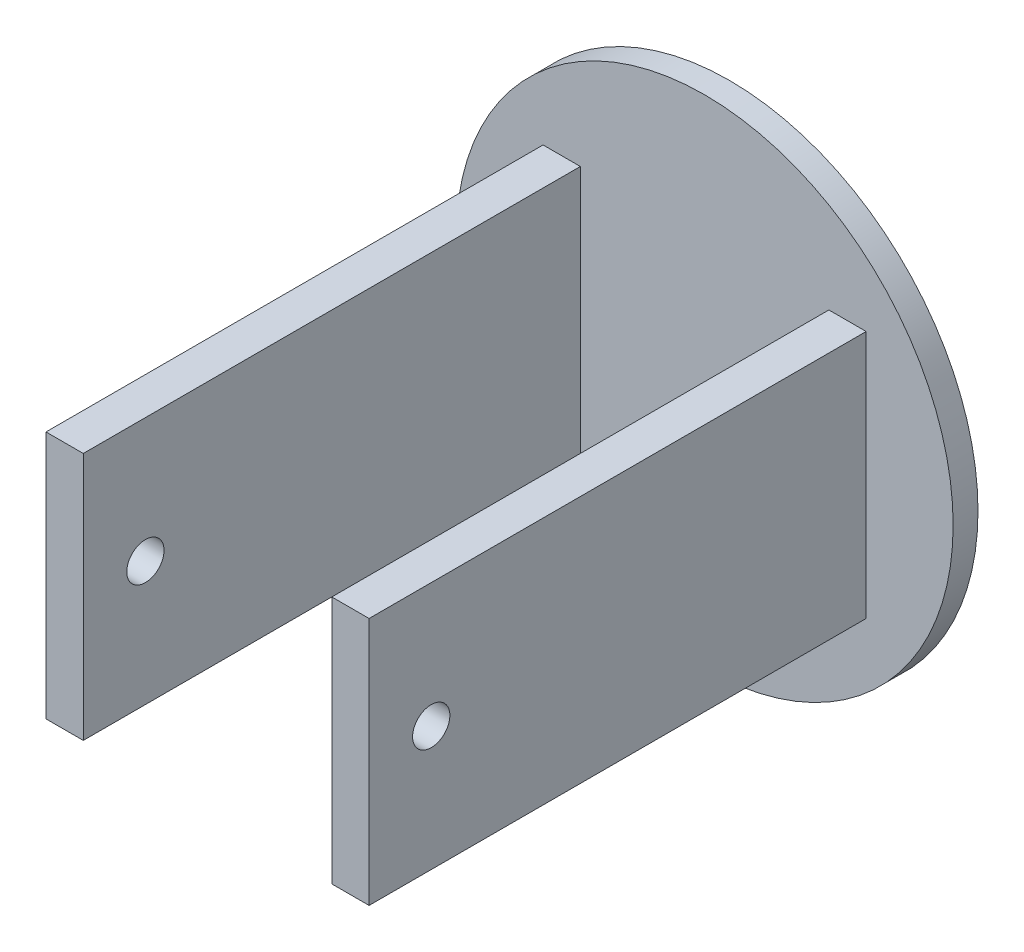
from build123d import *

# Parameters (mm, degrees)
SKETCH1_R           = 20
BOSS_EXTRUDE1_DEPTH = 2
SKETCH2_R           = 2
BOSS_EXTRUDE2_DEPTH = 1
SKETCH3_W           = 3
SKETCH3_H           = 20
BOSS_EXTRUDE3_DEPTH = 40
SKETCH5_R           = 1.5
CUT_EXTRUDE1_DEPTH  = 58.035076926


with BuildPart() as part:
    # Sketch1 → Boss-Extrude1 (new body)
    with BuildSketch(Plane.XY):
        Circle(SKETCH1_R)
    extrude(amount=BOSS_EXTRUDE1_DEPTH)

    # Sketch2 → Boss-Extrude2 (add)
    with BuildSketch(Plane(origin=(0, 0, 0), x_dir=(-1, 0, 0), z_dir=(0, 0, -1))):
        with Locations(Location((0, 0, 0), (0, 0, 180))):
            Circle(SKETCH2_R)
    extrude(amount=BOSS_EXTRUDE2_DEPTH)

    # Sketch3 → Boss-Extrude3 (add)
    with BuildSketch(Plane.XY.offset(2)):
        with Locations((-11.5, 0)):
            Rectangle(SKETCH3_W, SKETCH3_H)
    boss_extrude3 = extrude(amount=BOSS_EXTRUDE3_DEPTH)

    # Mirror1: Boss-Extrude3 across plane
    add(boss_extrude3.mirror(Plane(origin=(0, 0, 0), x_dir=(0, 0, 1), z_dir=(1, 0, 0))))

    # Sketch5 → Cut-Extrude1 (cut, through all)
    with BuildSketch(Plane.ZY.offset(13)):
        with Locations(Location((37, 0, 0), (0, 0, 270))):
            Circle(SKETCH5_R)
    extrude(amount=-CUT_EXTRUDE1_DEPTH, mode=Mode.SUBTRACT)


solid = part.part
